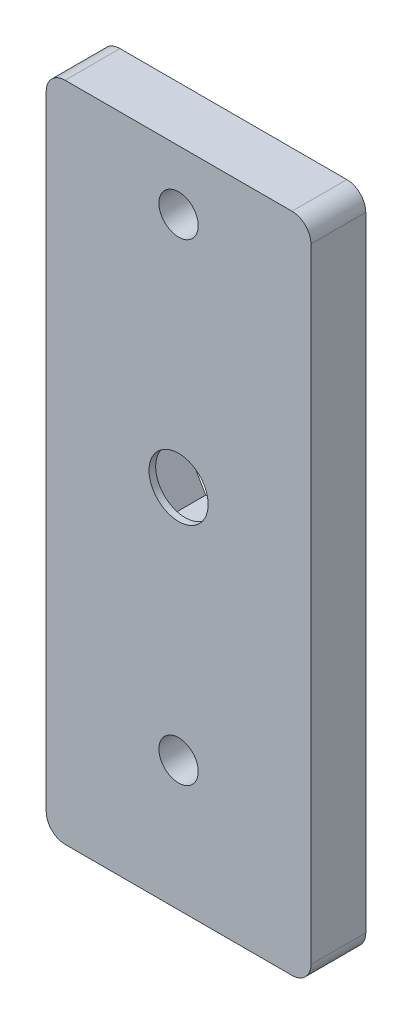
from build123d import *

# Parameters (mm, degrees)
SKETCH1_W           = 27.998507133
SKETCH1_H           = 69.998003006
SKETCH1_R           = 2.078999996
SKETCH1_R_2         = 3.125
SKETCH1_R_3         = 2.078894146
BOSS_EXTRUDE1_DEPTH = 5.8
CUT_EXTRUDE1_DEPTH  = 5.1
FILLET1_R           = 2


with BuildPart() as part:
    # Sketch1 → Boss-Extrude1 (new body)
    with BuildSketch(Plane.XY):
        with Locations((0.000746433, -0.000998497)):
            Rectangle(SKETCH1_W, SKETCH1_H)
        with Locations((0.000493893, -21.295000553)):
            Circle(SKETCH1_R, mode=Mode.SUBTRACT)
        with Locations((0, 3.703561495)):
            Circle(SKETCH1_R_2, mode=Mode.SUBTRACT)
        with Locations((0.000493654, 28.705001831)):
            Circle(SKETCH1_R_3, mode=Mode.SUBTRACT)
    extrude(amount=BOSS_EXTRUDE1_DEPTH)

    # Sketch2 → Cut-Extrude1 (cut)
    with BuildSketch(Plane(origin=(0, 0, 0), x_dir=(-1, 0, 0), z_dir=(0, 0, -1))):
        Polygon((2.928753578, 8.776311495), (-2.928753578, 8.776311495), (-5.857507156, 3.703561495), (-2.928753578, -1.369188505), (2.928753578, -1.369188505), (5.857507156, 3.703561495), align=None)
    extrude(amount=-CUT_EXTRUDE1_DEPTH, mode=Mode.SUBTRACT)

    # Fillet1
    fillet1_edges = [part.edges().sort_by_distance(p)[0] for p in [
        (-13.998507133, 34.998003006, 2.9),
        (14, 34.998003006, 2.9),
        (14, -35, 2.9),
        (-13.998507133, -35, 2.9),
    ]]
    fillet(fillet1_edges, radius=FILLET1_R)


solid = part.part
